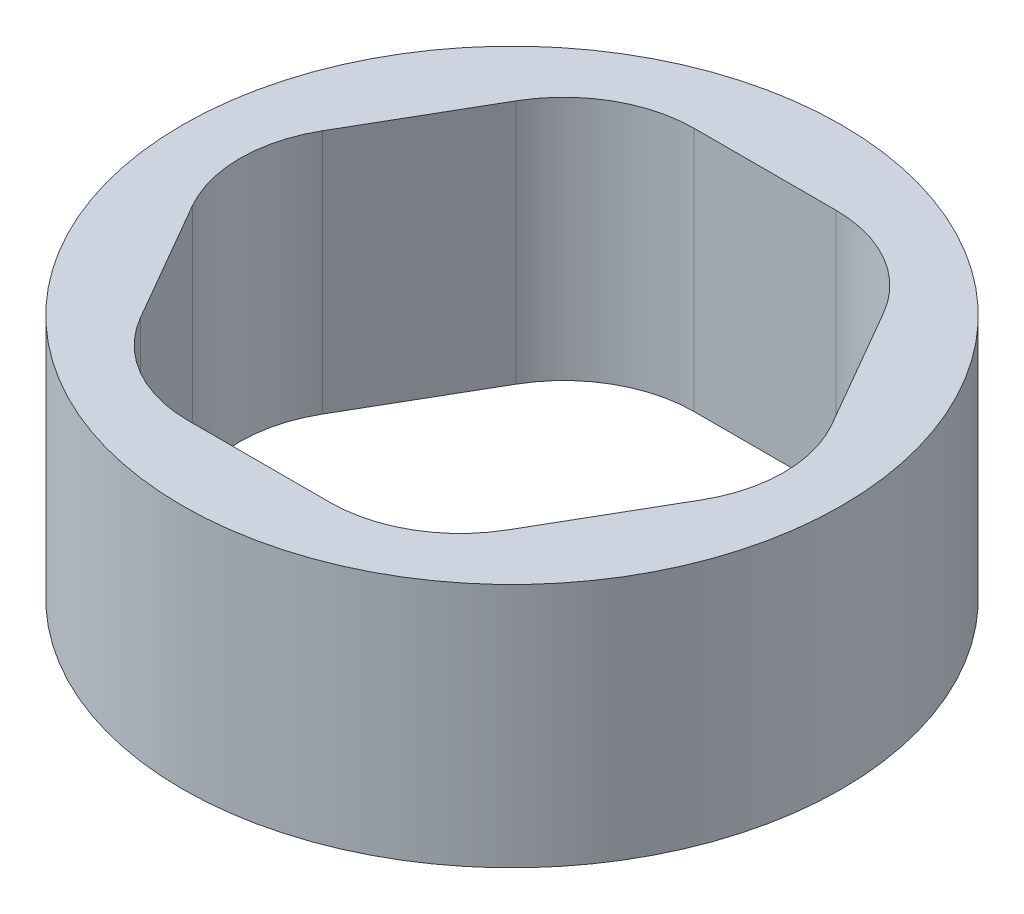
from build123d import *

# Parameters (mm, degrees)
SKETCH_1_R      = 21.5
EXTRUDE_1_DEPTH = 16
FILLET_1_R      = 8.5


with BuildPart() as part:
    # 草图1 → 凸台-拉伸1 (new body)
    with BuildSketch(Plane(origin=(0, 0, 0), x_dir=(1, 0, 0), z_dir=(0, 1, 0))):
        with Locations(Location((0, 0, 0), (0, 0, 270))):
            Circle(SKETCH_1_R)
        Polygon((9.526279442, -16.5), (19.052558883, 0), (9.526279442, 16.5), (-9.526279442, 16.5), (-19.052558883, 0), (-9.526279442, -16.5), align=None, mode=Mode.SUBTRACT)
    extrude(amount=EXTRUDE_1_DEPTH)

    # 圆角1
    fillet_1_edges = [part.edges().sort_by_distance(p)[0] for p in [
        (9.526279442, 8, 16.5),
        (19.052558883, 8, 0),
        (9.526279442, 8, -16.5),
        (-9.526279442, 8, -16.5),
        (-19.052558883, 8, 0),
        (-9.526279442, 8, 16.5),
    ]]
    fillet(fillet_1_edges, radius=FILLET_1_R)


solid = part.part
